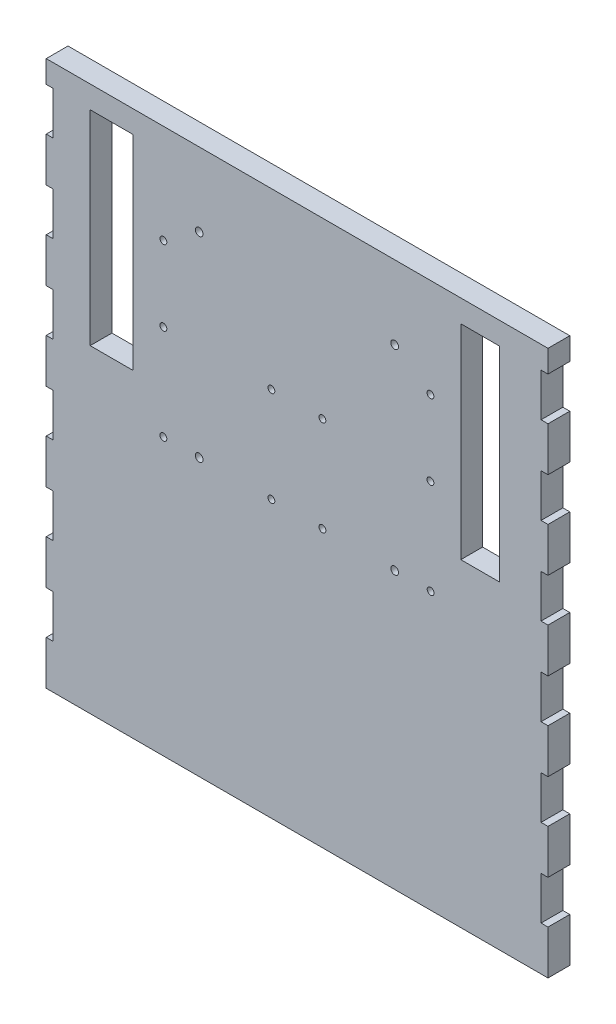
from build123d import *

# Parameters (mm, degrees)
MODEL_R             = 1.775
MODEL_R_2           = 1.575
MODEL_W             = 19.75
MODEL_H             = 93.75
MODEL_W_2           = 17.75
BOSS_EXTRUDE1_DEPTH = 10


with BuildPart() as part:
    # Model → Boss-Extrude1 (new body)
    with BuildSketch(Plane.XY):
        Polygon((57.946480534, -88.339102909), (57.946480534, -68.089102909), (54.771480534, -68.089102909), (54.771480534, -48.339102909), (57.946480534, -48.339102909), (57.946480534, -28.089102909), (54.771480534, -28.089102909), (54.771480534, -8.339102909), (57.946480534, -8.339102909), (57.946480534, 11.910897091), (54.771480534, 11.910897091), (54.771480534, 31.660897091), (57.946480534, 31.660897091), (57.946480534, 51.910897091), (54.771480534, 51.910897091), (54.771480534, 71.660897091), (57.946480534, 71.660897091), (57.946480534, 91.910897091), (54.771480534, 91.910897091), (54.771480534, 111.660897091), (57.946480534, 111.660897091), (57.946480534, 131.910897091), (54.771480534, 131.910897091), (54.771480534, 151.660897091), (57.946480534, 151.660897091), (57.946480534, 161.910897091), (-172.303519466, 161.910897091), (-172.303519466, 151.660897091), (-169.128519466, 151.660897091), (-169.128519466, 131.910897091), (-172.303519466, 131.910897091), (-172.303519466, 111.660897091), (-169.128519466, 111.660897091), (-169.128519466, 91.910897091), (-172.303519466, 91.910897091), (-172.303519466, 71.660897091), (-169.128519466, 71.660897091), (-169.128519466, 51.910897091), (-172.303519466, 51.910897091), (-172.303519466, 31.660897091), (-169.128519466, 31.660897091), (-169.128519466, 11.910897091), (-172.303519466, 11.910897091), (-172.303519466, -8.339102909), (-169.128519466, -8.339102909), (-169.128519466, -28.089102909), (-172.303519466, -28.089102909), (-172.303519466, -48.339102909), (-169.128519466, -48.339102909), (-169.128519466, -68.089102909), (-172.303519466, -68.089102909), (-172.303519466, -88.339102909), align=None)
        with Locations((-12.413986694, 38.429929163)):
            Circle(MODEL_R, mode=Mode.SUBTRACT)
        with Locations((4.096306466, 38.429929163)):
            Circle(MODEL_R_2, mode=Mode.SUBTRACT)
        with Locations((4.008638821, 82.124992621)):
            Circle(MODEL_R_2, mode=Mode.SUBTRACT)
        with Locations((-45.560089874, 82.12499262)):
            Circle(MODEL_R_2, mode=Mode.SUBTRACT)
        with Locations((-45.560089874, 38.429929163)):
            Circle(MODEL_R_2, mode=Mode.SUBTRACT)
        with Locations((-68.972284348, 38.429929163)):
            Circle(MODEL_R_2, mode=Mode.SUBTRACT)
        with Locations((-68.972284348, 82.12499262)):
            Circle(MODEL_R_2, mode=Mode.SUBTRACT)
        with Locations((-102.118387528, 38.429929163)):
            Circle(MODEL_R, mode=Mode.SUBTRACT)
        with Locations((-118.541013043, 38.429929163)):
            Circle(MODEL_R_2, mode=Mode.SUBTRACT)
        with Locations((-118.541013043, 82.12499262)):
            Circle(MODEL_R_2, mode=Mode.SUBTRACT)
        with Locations((-118.541013043, 116.547553094)):
            Circle(MODEL_R_2, mode=Mode.SUBTRACT)
        with Locations((-102.118387528, 128.129929163)):
            Circle(MODEL_R, mode=Mode.SUBTRACT)
        with Locations((-12.413986694, 128.129929163)):
            Circle(MODEL_R, mode=Mode.SUBTRACT)
        with Locations((4.008638821, 116.547553094)):
            Circle(MODEL_R_2, mode=Mode.SUBTRACT)
        with Locations((-142.266187111, 104.785897091)):
            Rectangle(MODEL_W, MODEL_H, mode=Mode.SUBTRACT)
        with Locations((26.821480534, 104.785897091)):
            Rectangle(MODEL_W_2, MODEL_H, mode=Mode.SUBTRACT)
    extrude(amount=BOSS_EXTRUDE1_DEPTH)


solid = part.part
